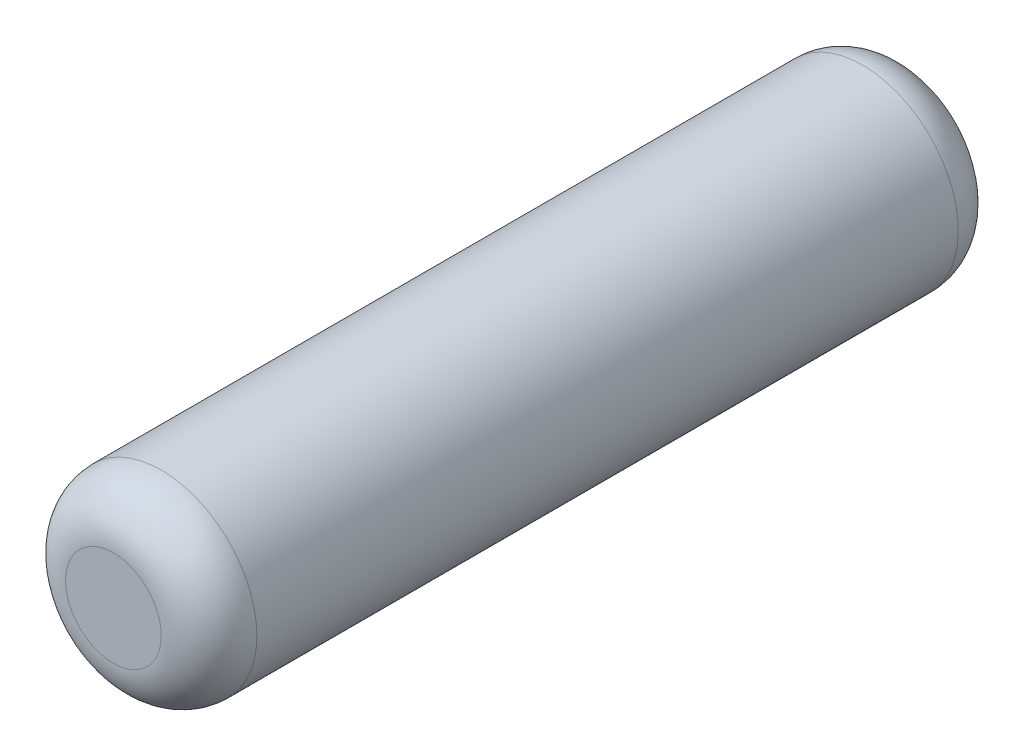
from build123d import *

# Parameters (mm, degrees)
SKETCH1_R           = 3
BOSS_EXTRUDE1_DEPTH = 25
FILLET1_R           = 1.5


with BuildPart() as part:
    # Sketch1 → Boss-Extrude1 (new body)
    with BuildSketch(Plane.XY):
        Circle(SKETCH1_R)
    extrude(amount=BOSS_EXTRUDE1_DEPTH)

    # Fillet1
    fillet1_edges = [part.edges().sort_by_distance(p)[0] for p in [
        (-3, 0, 0),
        (-3, 0, 25),
    ]]
    fillet(fillet1_edges, radius=FILLET1_R)


solid = part.part
